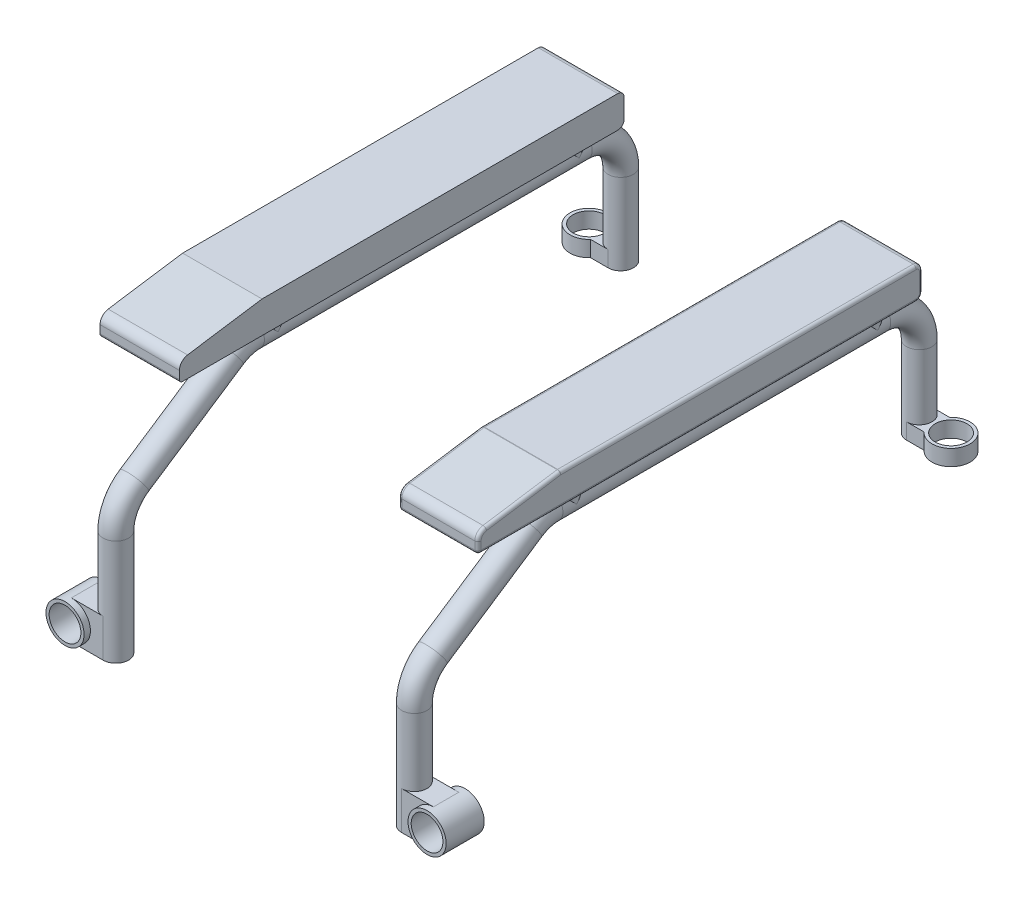
from build123d import *

# Parameters (mm, degrees)
SKETCH2_R                = 10.16
BOSS_EXTRUDE1_DEPTH      = 15.24
BOSS_EXTRUDE1_DEPTH_BACK = 15.24
SKETCH4_R                = 15.24
SKETCH5_R                = 10.16
BOSS_EXTRUDE2_DEPTH      = 15.24
SKETCH6_W                = 20.32
SKETCH6_H                = 30.48
BOSS_EXTRUDE3_DEPTH      = 25.4
SKETCH7_R                = 12.7
CUT_EXTRUDE1_DEPTH       = 461.805285208
SKETCH8_R                = 15.24
BOSS_EXTRUDE4_DEPTH      = 12.7
SKETCH10_W               = 20.32
SKETCH10_H               = 12.7
BOSS_EXTRUDE5_DEPTH      = 25.4
SKETCH11_R               = 12.7
CUT_EXTRUDE2_DEPTH       = 25.4
SKETCH12_R               = 10.16
BOSS_EXTRUDE6_DEPTH      = 25.4
BOSS_EXTRUDE7_DEPTH      = 31.75
BOSS_EXTRUDE7_DEPTH_BACK = 31.75
FILLET1_R                = 2.54
FILLET2_R                = 2.54


with BuildPart() as part:
    # Sweep1: sweep along a path in Sketch1
    with BuildLine(Plane(origin=(0, 0, 0), x_dir=(0, 0, -1), z_dir=(1, 0, 0))) as sweep1_path:
        Line((0, 0), (0, 69.32621332))
        ThreePointArc((0, 69.32621332), (3.933588394, 84.956346393), (14.797156867, 96.862523678))
        Line((14.797156867, 96.862523678), (90.432807933, 146.916310358))
        ThreePointArc((90.432807933, 146.916310358), (99.140625265, 150.999371974), (108.655651066, 152.4))
        Line((108.655651066, 152.4), (370.83999995, 152.4))
        ThreePointArc((370.83999995, 152.4), (394.188665865, 142.728665915), (403.85999995, 119.38))
        Line((403.85999995, 119.38), (403.85999995, 54.61))
    # Sketch2 → Sweep1 (sweep)
    with BuildSketch(Plane(origin=(0, 0, 0), x_dir=(1, 0, 0), z_dir=(0, 1, 0))):
        Circle(SKETCH2_R)
    sweep(path=sweep1_path.line)

    # Sketch5 → Boss-Extrude2 (add)
    with BuildSketch(Plane.XZ):
        with Locations(Location((0, 0, 0), (0, 0, 270))):
            Circle(SKETCH5_R)
    extrude(amount=BOSS_EXTRUDE2_DEPTH)



with BuildPart() as body_2:
    # Sketch4 → Boss-Extrude1 (new, two sides: drawn at the far end of the back side and taken through both)
    with BuildSketch(Plane.XY.offset(-BOSS_EXTRUDE1_DEPTH_BACK)):
        with Locations((-25.4, 0)):
            Circle(SKETCH4_R)
    extrude(amount=BOSS_EXTRUDE1_DEPTH + BOSS_EXTRUDE1_DEPTH_BACK)


with BuildPart() as part_1:
    add(part.part)

    add(body_2.part)  # Boss-Extrude3 merges body 2
    # Sketch6 → Boss-Extrude3 (add)
    with BuildSketch(Plane(origin=(0, 0, 0), x_dir=(0, 0, -1), z_dir=(1, 0, 0))):
        Rectangle(SKETCH6_W, SKETCH6_H)
    extrude(amount=-BOSS_EXTRUDE3_DEPTH)

    # Sketch7 → Cut-Extrude1 (cut, through all)
    with BuildSketch(Plane.XY.offset(15.24)):
        with Locations((-25.4, 0)):
            Circle(SKETCH7_R)
    extrude(amount=-CUT_EXTRUDE1_DEPTH, mode=Mode.SUBTRACT)



with BuildPart() as body_2_2:
    # Sketch8 → Boss-Extrude4 (new body)
    with BuildSketch(Plane(origin=(0, 54.61, 0), x_dir=(1, 0, 0), z_dir=(0, 1, 0))):
        with Locations(Location((-25.4, 403.85999995, 0), (0, 0, 270))):
            Circle(SKETCH8_R)
    extrude(amount=BOSS_EXTRUDE4_DEPTH)


with BuildPart() as part_2:
    add(part_1.part)

    add(body_2_2.part)  # Boss-Extrude5 merges body 2 2
    # Sketch10 → Boss-Extrude5 (add)
    with BuildSketch(Plane(origin=(0, 0, 0), x_dir=(0, 0, -1), z_dir=(1, 0, 0))):
        with Locations((403.85999995, 60.96)):
            Rectangle(SKETCH10_W, SKETCH10_H)
    extrude(amount=-BOSS_EXTRUDE5_DEPTH)

    # Sketch11 → Cut-Extrude2 (cut)
    with BuildSketch(Plane(origin=(0, 67.31, 0), x_dir=(1, 0, 0), z_dir=(0, 1, 0))):
        with Locations(Location((-25.4, 403.85999995, 0), (0, 0, 270))):
            Circle(SKETCH11_R)
    extrude(amount=-CUT_EXTRUDE2_DEPTH, mode=Mode.SUBTRACT)

    # Sketch12 → Boss-Extrude6 (add)
    with BuildSketch(Plane(origin=(0, 152.4, 0), x_dir=(1, 0, 0), z_dir=(0, 1, 0))):
        with Locations(Location((0, 360.410118202, 0), (0, 0, 270))):
            Circle(SKETCH12_R)
        with Locations(Location((0, 119.55398348, 0), (0, 0, 270))):
            Circle(SKETCH12_R)
    extrude(amount=BOSS_EXTRUDE6_DEPTH)

    # Sketch13 → Boss-Extrude7 (add, two sides: drawn at the far end of the back side and taken through both)
    with BuildSketch(Plane(origin=(0, 0, 0), x_dir=(0, 0, -1), z_dir=(1, 0, 0)).offset(-BOSS_EXTRUDE7_DEPTH_BACK)):
        with BuildLine():
            Line((369.685709653, 177.8), (21.679996961, 177.8))
            ThreePointArc((21.679996961, 177.8), (19.883945737, 178.543948776), (19.139996961, 180.34))
            Line((19.139996961, 180.34), (19.139996961, 186.682610789))
            ThreePointArc((19.139996961, 186.682610789), (20.983953383, 191.652693342), (25.623388191, 194.217364966))
            Line((25.623388191, 194.217364966), (85.170656017, 203.2))
            Line((85.170656017, 203.2), (369.685709653, 203.2))
            ThreePointArc((369.685709653, 203.2), (373.277812101, 201.712102448), (374.765709653, 198.12))
            Line((374.765709653, 198.12), (374.765709653, 182.88))
            ThreePointArc((374.765709653, 182.88), (373.277812101, 179.287897552), (369.685709653, 177.8))
        make_face()
    extrude(amount=BOSS_EXTRUDE7_DEPTH + BOSS_EXTRUDE7_DEPTH_BACK)


with BuildPart() as body_2_3:
    # Mirror1: mirrored copy
    add(part_2.part.mirror(Plane(origin=(119.38, 0, 0), x_dir=(0, 0, 1), z_dir=(1, 0, 0))))

    # Fillet1
    fillet1_edges = [body_2_3.edges().sort_by_distance(p)[0] for p in [
        (270.51, 177.8, -195.682853307),
        (270.51, 198.708682483, -55.397022104),
        (270.51, 203.2, -227.428182835),
        (270.51, 201.712102448, -373.277812101),
        (270.51, 190.5, -374.765709653),
        (270.51, 179.287897552, -373.277812101),
        (270.51, 178.543948776, -19.883945737),
        (270.51, 183.511305395, -19.139996961),
        (270.51, 191.652693342, -20.983953383),
        (207.01, 198.708682483, -55.397022104),
        (207.01, 191.652693342, -20.983953383),
        (207.01, 183.511305395, -19.139996961),
        (207.01, 178.543948776, -19.883945737),
        (207.01, 177.8, -195.682853307),
        (207.01, 179.287897552, -373.277812101),
        (207.01, 190.5, -374.765709653),
        (207.01, 201.712102448, -373.277812101),
        (207.01, 203.2, -227.428182835),
    ]]
    fillet(fillet1_edges, radius=FILLET1_R)

    # Fillet2
    fillet2_edges = [body_2_3.edges().sort_by_distance(p)[0] for p in [
        (238.76, 203.2, -85.170656017),
        (207.752690681, 202.454792247, -85.226546707),
        (269.767310094, 202.454791472, -85.226546765),
    ]]
    fillet(fillet2_edges, radius=FILLET2_R)


solid = Compound([part_2.part, body_2_3.part])
